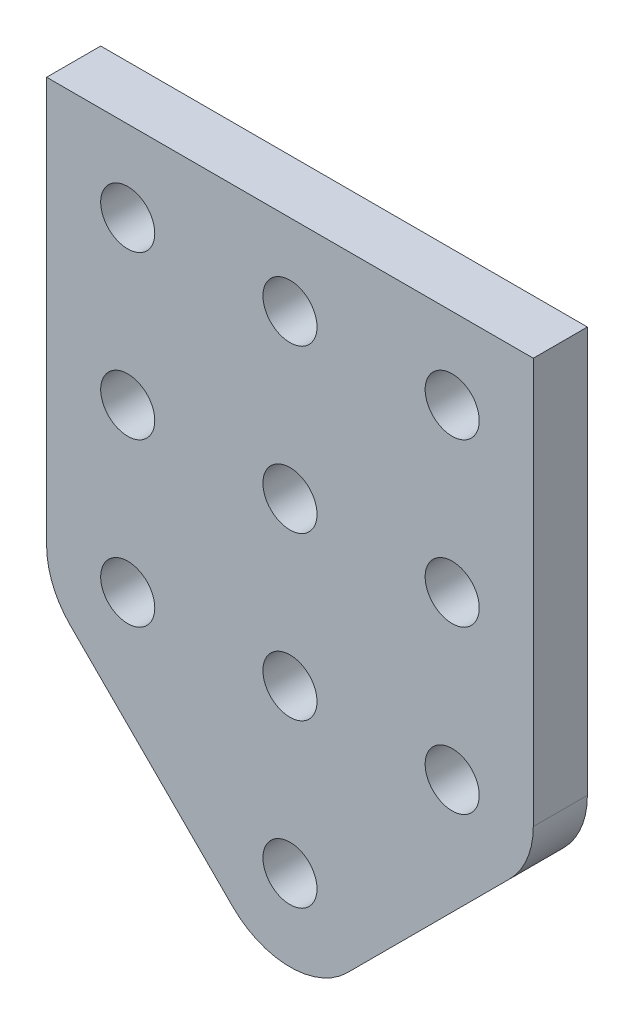
from build123d import *

# Parameters (mm, degrees)
MODEL_R                 = 1.5
SALIENTE_EXTRUIR1_DEPTH = 3


with BuildPart() as part:
    # Model → Saliente-Extruir1 (new body)
    with BuildSketch(Plane.XY):
        with BuildLine():
            Line((174.227054575, 213.178720063), (174.227054575, 204.178720063))
            ThreePointArc((174.227054575, 204.178720063), (174.569596678, 202.456644617), (175.545074059, 200.996739548))
            Line((175.545074059, 200.996739548), (184.545074059, 191.996739548))
            ThreePointArc((184.545074059, 191.996739548), (187.727054575, 190.678720063), (190.90903509, 191.996739548))
            Line((190.90903509, 191.996739548), (199.90903509, 200.996739548))
            ThreePointArc((199.90903509, 200.996739548), (200.884512471, 202.456644617), (201.227054575, 204.178720063))
            Line((201.227054575, 204.178720063), (201.227054575, 226.678720063))
            Line((201.227054575, 226.678720063), (174.227054575, 226.678720063))
            Line((174.227054575, 226.678720063), (174.227054575, 213.178720063))
        make_face()
        with Locations((187.727054575, 204.178720063)):
            Circle(MODEL_R, mode=Mode.SUBTRACT)
        with Locations((178.727054575, 204.178720063)):
            Circle(MODEL_R, mode=Mode.SUBTRACT)
        with Locations((187.727054575, 213.178720063)):
            Circle(MODEL_R, mode=Mode.SUBTRACT)
        with Locations((178.727054575, 213.178720063)):
            Circle(MODEL_R, mode=Mode.SUBTRACT)
        with Locations((196.727054575, 213.178720063)):
            Circle(MODEL_R, mode=Mode.SUBTRACT)
        with Locations((187.727054575, 195.178720063)):
            Circle(MODEL_R, mode=Mode.SUBTRACT)
        with Locations((196.727054575, 204.178720063)):
            Circle(MODEL_R, mode=Mode.SUBTRACT)
        with Locations((187.727054575, 222.178720063)):
            Circle(MODEL_R, mode=Mode.SUBTRACT)
        with Locations((178.727054575, 222.178720063)):
            Circle(MODEL_R, mode=Mode.SUBTRACT)
        with Locations((196.727054575, 222.178720063)):
            Circle(MODEL_R, mode=Mode.SUBTRACT)
    extrude(amount=SALIENTE_EXTRUIR1_DEPTH)


solid = part.part
